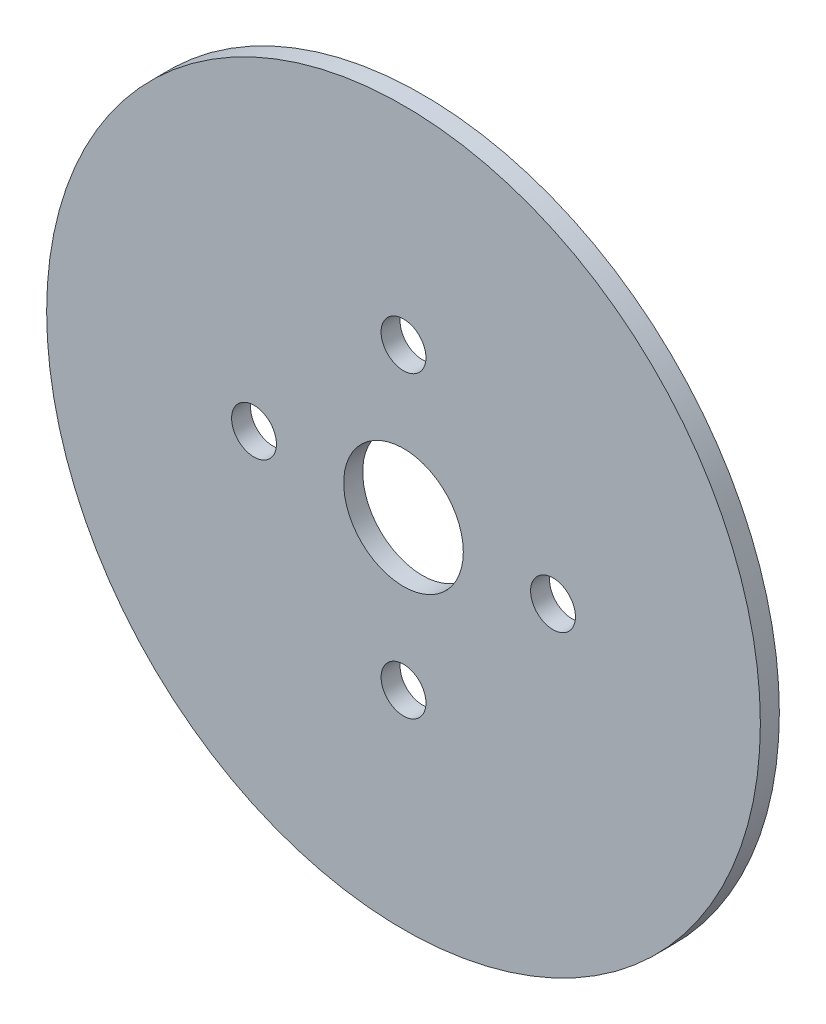
from build123d import *

# Parameters (mm, degrees)
SKETCH1_R           = 23.87
SKETCH1_R_2         = 1.5
SKETCH1_R_3         = 4
BOSS_EXTRUDE2_DEPTH = 1.27


with BuildPart() as part:
    # Sketch1 → Boss-Extrude2 (new body)
    with BuildSketch(Plane.XY):
        Circle(SKETCH1_R)
        with Locations((0, 10)):
            Circle(SKETCH1_R_2, mode=Mode.SUBTRACT)
        Circle(SKETCH1_R_3, mode=Mode.SUBTRACT)
        with Locations((10, 0)):
            Circle(SKETCH1_R_2, mode=Mode.SUBTRACT)
        with Locations((0, -10)):
            Circle(SKETCH1_R_2, mode=Mode.SUBTRACT)
        with Locations((-10, 0)):
            Circle(SKETCH1_R_2, mode=Mode.SUBTRACT)
    extrude(amount=BOSS_EXTRUDE2_DEPTH)


solid = part.part
